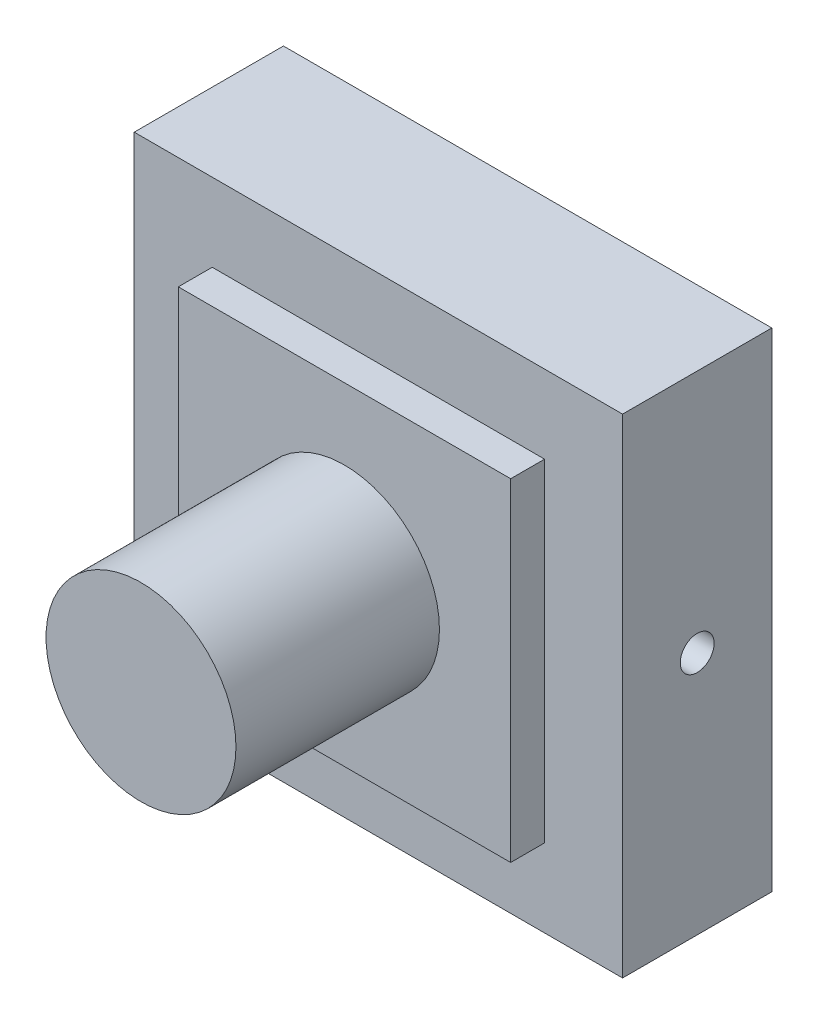
from build123d import *

# Parameters (mm, degrees)
SKETCH_1_W              = 36
SKETCH_1_H              = 36
EXTRUDE_1_DEPTH         = 11
SKETCH_2_W              = 24.5
SKETCH_2_H              = 24.5
EXTRUDE_2_DEPTH         = 2.5
SKETCH_3_R              = 7
EXTRUDE_3_DEPTH         = 15
HOLE_WIZARD_2_5_2_5_1_D = 2.5


with BuildPart() as part:
    # 草图1 → 凸台-拉伸1 (new body)
    with BuildSketch(Plane.XY):
        Rectangle(SKETCH_1_W, SKETCH_1_H)
    extrude(amount=EXTRUDE_1_DEPTH)

    # 草图2 → 凸台-拉伸2 (add)
    with BuildSketch(Plane.XY.offset(11)):
        Rectangle(SKETCH_2_W, SKETCH_2_H)
    extrude(amount=EXTRUDE_2_DEPTH)

    # 草图3 → 凸台-拉伸3 (add)
    with BuildSketch(Plane.XY.offset(13.5)):
        Circle(SKETCH_3_R)
    extrude(amount=EXTRUDE_3_DEPTH)

    # Ø2.5 (2.5) 直径孔1 (through all)
    with Locations(Plane(origin=(18, 0, 0), x_dir=(0, 0, -1), z_dir=(1, 0, 0))):
        with Locations((-5.5, 0)):
            Hole(HOLE_WIZARD_2_5_2_5_1_D / 2)


solid = part.part
